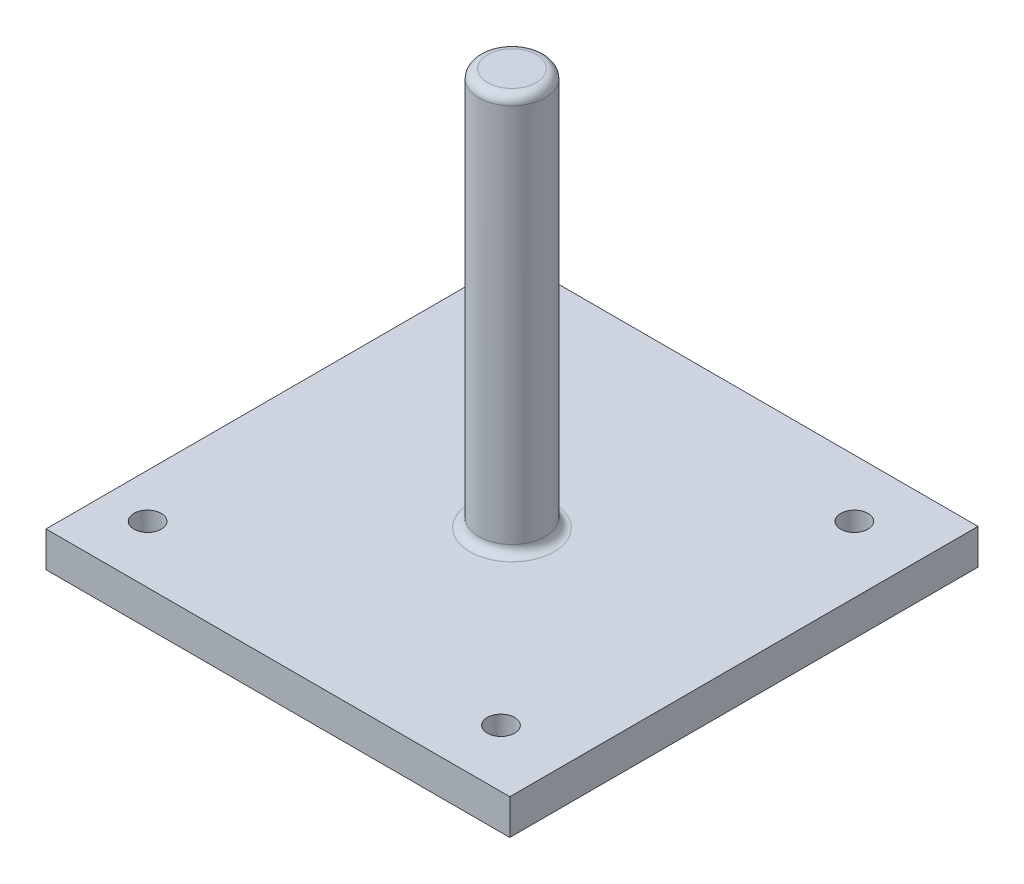
from build123d import *

# Parameters (mm, degrees)
SKETCH_1_W          = 105
SKETCH_1_H          = 106
EXTRUDE_1_DEPTH     = 8
SKETCH_3_R          = 3.1
CUT_EXTRUDE_1_DEPTH = 10
SKETCH_5_R          = 7.5
EXTRUDE_2_DEPTH     = 90
FILLET_1_R          = 2


with BuildPart() as part:
    # 草图1 → 凸台-拉伸1 (new body)
    with BuildSketch(Plane(origin=(0, 0, 0), x_dir=(1, 0, 0), z_dir=(0, 1, 0))):
        with Locations((52.5, 53)):
            Rectangle(SKETCH_1_W, SKETCH_1_H)
    extrude(amount=EXTRUDE_1_DEPTH)

    # 草图3 → 切除-拉伸1 (cut)
    with BuildSketch(Plane(origin=(0, 8, 0), x_dir=(1, 0, 0), z_dir=(0, 1, 0))):
        with Locations(Location((90, 13, 0), (0, 0, 270))):
            Circle(SKETCH_3_R)
        with Locations(Location((90, 93, 0), (0, 0, 270))):
            Circle(SKETCH_3_R)
        with Locations(Location((10, 93, 0), (0, 0, 270))):
            Circle(SKETCH_3_R)
        with Locations(Location((10, 13, 0), (0, 0, 270))):
            Circle(SKETCH_3_R)
    extrude(amount=-CUT_EXTRUDE_1_DEPTH, mode=Mode.SUBTRACT)

    # 草图5 → 凸台-拉伸2 (add)
    with BuildSketch(Plane(origin=(0, 8, 0), x_dir=(1, 0, 0), z_dir=(0, 1, 0))):
        with Locations(Location((52.5, 53, 0), (0, 0, 90))):
            Circle(SKETCH_5_R)
    extrude(amount=EXTRUDE_2_DEPTH)

    # 圆角1
    fillet_1_edges = [part.edges().sort_by_distance(p)[0] for p in [
        (52.5, 8, -45.5),
        (52.5, 98, -45.5),
    ]]
    fillet(fillet_1_edges, radius=FILLET_1_R)


solid = part.part
